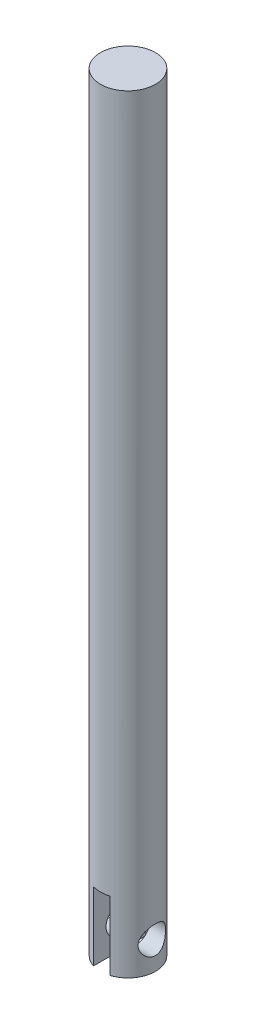
from build123d import *

# Parameters (mm, degrees)
SKETCH_1_R               = 2
EXTRUDE_1_DEPTH          = 55.9
CUT_EXTRUDE_1_DEPTH      = 56.97151061
CUT_EXTRUDE_1_DEPTH_BACK = 56.97151061
SKETCH_2_W               = 1.2
SKETCH_2_H               = 10
CUT_EXTRUDE_2_DEPTH      = 56.97151061
CUT_EXTRUDE_2_DEPTH_BACK = 56.97151061
SKETCH_3_R               = 1


with BuildPart() as part:
    # 草图1 → 凸台-拉伸1 (new body)
    with BuildSketch(Plane(origin=(0, 0, 0), x_dir=(1, 0, 0), z_dir=(0, 1, 0))):
        with Locations(Location((0, 0, 0), (0, 0, 270))):
            Circle(SKETCH_1_R)
    extrude(amount=EXTRUDE_1_DEPTH)

    # 草图2 → 切除-拉伸1 (cut, two sides: drawn at the far end of the back side and taken through both)
    with BuildSketch(Plane.XY.offset(-CUT_EXTRUDE_1_DEPTH_BACK)):
        Rectangle(SKETCH_2_W, SKETCH_2_H)
    extrude(amount=CUT_EXTRUDE_1_DEPTH + CUT_EXTRUDE_1_DEPTH_BACK, mode=Mode.SUBTRACT)

    # 草图3 → 切除-拉伸2 (cut, two sides: drawn at the far end of the back side and taken through both)
    with BuildSketch(Plane(origin=(0, 0, 0), x_dir=(0, 0, -1), z_dir=(1, 0, 0)).offset(-CUT_EXTRUDE_2_DEPTH_BACK)):
        with Locations((0, 2)):
            Circle(SKETCH_3_R)
    extrude(amount=CUT_EXTRUDE_2_DEPTH + CUT_EXTRUDE_2_DEPTH_BACK, mode=Mode.SUBTRACT)


solid = part.part
